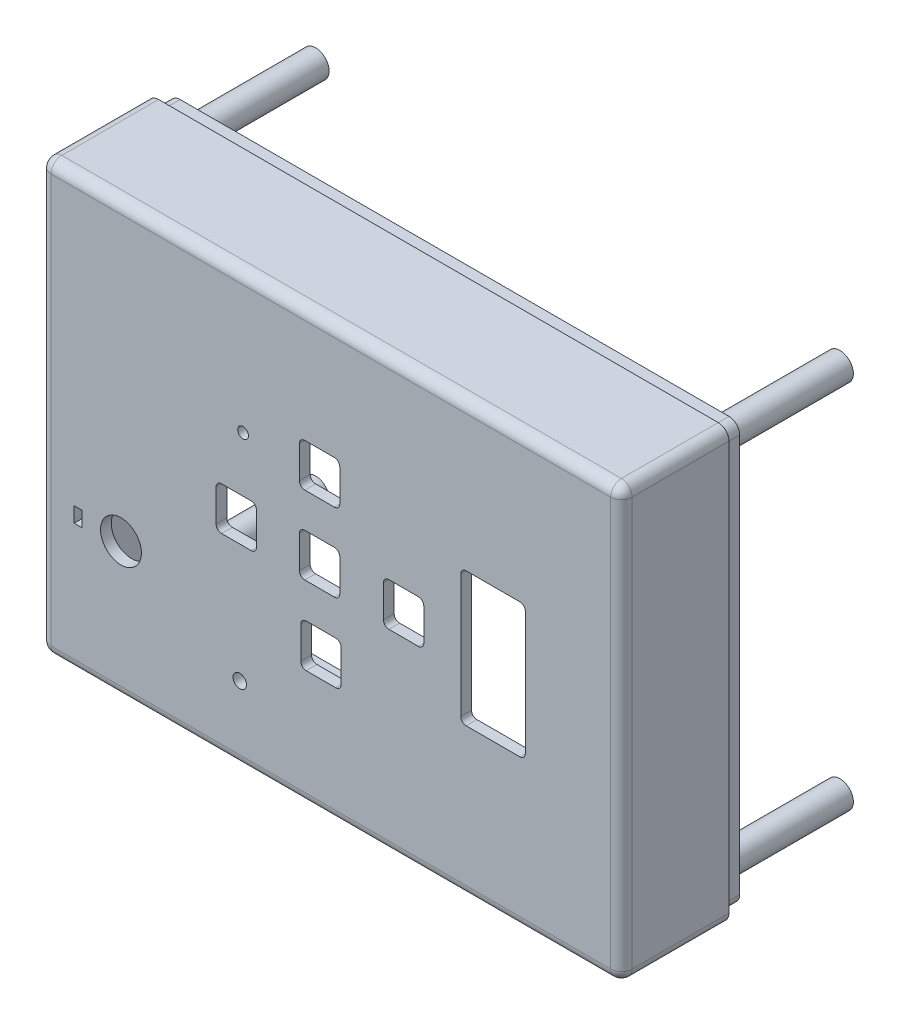
from build123d import *

# Parameters (mm, degrees)
BOSS_EXTRUDE1_DEPTH                       = 5
BOSS_EXTRUDE1_DEPTH_BACK                  = 15
SKETCH2_W                                 = 108.058124592
SKETCH2_H                                 = 80
SHELL4_T                                  = -2
SKETCH1_R                                 = 1
SKETCH1_R_2                               = 3.8
SKETCH1_W                                 = 7.5000007
SKETCH1_H                                 = 7.999999344
SKETCH1_W_2                               = 7.50000035
SKETCH1_H_2                               = 7.999999672
SKETCH1_H_3                               = 7.999999673
SKETCH1_W_3                               = 12
SKETCH1_H_4                               = 24.955992996
SKETCH1_W_4                               = 1.5
SKETCH1_H_5                               = 2.8
CUT_EXTRUDE1_DEPTH                        = 10
FILLET2_R                                 = 2
FILLET3_R                                 = 1
SKETCH5_R                                 = 2.5
BOSS_EXTRUDE3_DEPTH                       = 41
BOSS_EXTRUDE3_2_DEPTH                     = 41
BOSS_EXTRUDE3_3_DEPTH                     = 41
BOSS_EXTRUDE3_4_DEPTH                     = 41
SKETCH6_R                                 = 1.25
CUT_EXTRUDE2_DEPTH                        = 108.680047108
SKETCH7_W                                 = 106.058124592
SKETCH7_H                                 = 78
BOSS_EXTRUDE4_DEPTH                       = 3
F_34_0_111_DIAMETER_HOLE1_AT_2_COUNT      = 2
F_34_0_111_DIAMETER_HOLE1_AT_2_PITCH      = 97.471911114
F_34_0_111_DIAMETER_HOLE1_AT_3_COUNT      = 2
F_34_0_111_DIAMETER_HOLE1_AT_3_PITCH      = 119.398071447
F_34_0_111_DIAMETER_HOLE1_AT_4_COUNT      = 2
F_34_0_111_DIAMETER_HOLE1_AT_4_PITCH      = 68.957421711
SKETCH11_R                                = 2.9
BOSS_EXTRUDE5_DEPTH                       = 10
CSK_FOR_2_FLAT_HEAD_MACHINE_SCREW_2_COUNT = 2
CSK_FOR_2_FLAT_HEAD_MACHINE_SCREW_2_PITCH = 29.21
CSK_FOR_2_FLAT_HEAD_MACHINE_SCREW_3_COUNT = 2
CSK_FOR_2_FLAT_HEAD_MACHINE_SCREW_3_PITCH = 78.188486275
CSK_FOR_2_FLAT_HEAD_MACHINE_SCREW_4_COUNT = 2
CSK_FOR_2_FLAT_HEAD_MACHINE_SCREW_4_PITCH = 64.503754884
FILLET4_R                                 = 1
FILLET5_R                                 = 2


with BuildPart() as part:
    # Sketch2 → Boss-Extrude1 (new, two sides: drawn at the far end of the back side and taken through both)
    with BuildSketch(Plane.XY.offset(-BOSS_EXTRUDE1_DEPTH_BACK)):
        with Locations((-26.35506251, -18.756999791)):
            Rectangle(SKETCH2_W, SKETCH2_H)
    extrude(amount=BOSS_EXTRUDE1_DEPTH + BOSS_EXTRUDE1_DEPTH_BACK)

    # Shell4
    shell4_openings = [part.faces().sort_by_distance(p)[0] for p in [
        (-26.35506251, -18.756999791, -15),
    ]]
    offset(amount=SHELL4_T, openings=shell4_openings, kind=Kind.INTERSECTION)

    # Sketch1 → Cut-Extrude1 (cut)
    with BuildSketch(Plane.XY):
        with Locations((-42.67200177, -4.571998962)):
            Circle(SKETCH1_R)
        with Locations((-65.384124806, -33.407883165)):
            Circle(SKETCH1_R_2)
        with Locations((-28.194001129, -33.019997009)):
            Rectangle(SKETCH1_W, SKETCH1_H)
        with Locations((-28.447998932, -4.064003357)):
            Rectangle(SKETCH1_W, SKETCH1_H)
        with Locations((-28.447998932, -18.542000183)):
            Rectangle(SKETCH1_W, SKETCH1_H)
        with Locations((-43.941998413, -18.795997986)):
            Rectangle(SKETCH1_W_2, SKETCH1_H_2)
        with Locations((-12.827000549, -18.668999085)):
            Rectangle(SKETCH1_W_2, SKETCH1_H_3)
        with Locations((3.8, -18.542000183)):
            Rectangle(SKETCH1_W_3, SKETCH1_H_4)
        with Locations((-73.334440798, -33.438010953)):
            Rectangle(SKETCH1_W_4, SKETCH1_H_5)
    extrude(amount=CUT_EXTRUDE1_DEPTH, mode=Mode.SUBTRACT)

    # Fillet2
    fillet2_edges = [part.edges().sort_by_distance(p)[0] for p in [
        (-80.384124806, -18.756999791, 5),
        (-26.35506251, -58.756999791, 5),
        (27.673999786, -18.756999791, 5),
        (-26.35506251, 21.243000209, 5),
        (-80.384124806, 21.243000209, -5),
        (27.673999786, 21.243000209, -5),
        (27.673999786, -58.756999791, -5),
        (-80.384124806, -58.756999791, -5),
    ]]
    fillet(fillet2_edges, radius=FILLET2_R)

    # Fillet3
    fillet3_edges = [part.edges().sort_by_distance(p)[0] for p in [
        (-78.384124806, -56.756999791, -6),
        (-78.384124806, 19.243000209, -6),
        (25.673999786, 19.243000209, -6),
        (25.673999786, -56.756999791, -6),
        (-78.384124806, -18.756999791, 3),
        (-26.35506251, -56.756999791, 3),
        (25.673999786, -18.756999791, 3),
        (-26.35506251, 19.243000209, 3),
    ]]
    fillet(fillet3_edges, radius=FILLET3_R)

    # Sketch6 → Cut-Extrude2 (cut, through all)
    with BuildSketch(Plane.XY):
        with Locations((-43.300399836, -44.849637416)):
            Circle(SKETCH6_R)
    extrude(amount=CUT_EXTRUDE2_DEPTH, mode=Mode.SUBTRACT)

    # Sketch7 → Boss-Extrude4 (add)
    with BuildSketch(Plane(origin=(0, 0, -15), x_dir=(-1, 0, 0), z_dir=(0, 0, -1))):
        with Locations((26.35506251, -18.756999791)):
            Rectangle(SKETCH7_W, SKETCH7_H)
        with BuildLine():
            Line((-24.673999786, 19.243000209), (77.384124806, 19.243000209))
            ThreePointArc((77.384124806, 19.243000209), (78.091231587, 18.950106991), (78.384124806, 18.243000209))
            Line((78.384124806, 18.243000209), (78.384124806, -55.756999791))
            ThreePointArc((78.384124806, -55.756999791), (78.091231587, -56.464106572), (77.384124806, -56.756999791))
            Line((77.384124806, -56.756999791), (-24.673999786, -56.756999791))
            ThreePointArc((-24.673999786, -56.756999791), (-25.381106568, -56.464106572), (-25.673999786, -55.756999791))
            Line((-25.673999786, -55.756999791), (-25.673999786, 18.243000209))
            ThreePointArc((-25.673999786, 18.243000209), (-25.381106568, 18.950106991), (-24.673999786, 19.243000209))
        make_face(mode=Mode.SUBTRACT)
    extrude(amount=BOSS_EXTRUDE4_DEPTH)

    # Sketch11 → Boss-Extrude5 (add)
    with BuildSketch(Plane(origin=(0, 0, 3), x_dir=(-1, 0, 0), z_dir=(0, 0, -1))):
        with Locations(Location((50.165, 1.575601264, 0), (0, 0, 180))):
            Circle(SKETCH11_R)
        with Locations(Location((50.165, -52.451, 0), (0, 0, 180))):
            Circle(SKETCH11_R)
        with Locations(Location((-13.716, -7.366, 0), (0, 0, 180))):
            Circle(SKETCH11_R)
        with Locations(Location((-13.716, -36.576, 0), (0, 0, 180))):
            Circle(SKETCH11_R)
    extrude(amount=BOSS_EXTRUDE5_DEPTH)

    # Sketch12 → CSK for #2 Flat Head Machine Screw (100)1 (revolve, cut)
    with BuildSketch(Plane(origin=(13.716, -7.366, -7), x_dir=(0, 1, 0), z_dir=(1, 0, 0))):
        Polygon((0, 0), (0, 5), (1.2192, 4.267430733), (1.2192, 0.809898964), (2.1844, 0), align=None)
    csk_for_2_flat_head_machine_screw_100 = revolve(axis=Axis((13.716, -7.366, -13.35), (0, 0, 1)), mode=Mode.SUBTRACT)

    # CSK for _2 Flat Head Machine Screw _ 2: CSK for #2 Flat Head Machine Screw (100)1 ×2
    with Locations(*[(0, -i * CSK_FOR_2_FLAT_HEAD_MACHINE_SCREW_2_PITCH, 0) for i in range(1, CSK_FOR_2_FLAT_HEAD_MACHINE_SCREW_2_COUNT)]):
        add(csk_for_2_flat_head_machine_screw_100, mode=Mode.SUBTRACT)

    # CSK for _2 Flat Head Machine Screw _ 3: CSK for #2 Flat Head Machine Screw (100)1 ×2
    with Locations(*[Vector(-0.8170128754660291, -0.5766194250306964, 0) * (i * CSK_FOR_2_FLAT_HEAD_MACHINE_SCREW_3_PITCH) for i in range(1, CSK_FOR_2_FLAT_HEAD_MACHINE_SCREW_3_COUNT)]):
        add(csk_for_2_flat_head_machine_screw_100, mode=Mode.SUBTRACT)

    # CSK for _2 Flat Head Machine Screw _ 4: CSK for #2 Flat Head Machine Screw (100)1 ×2
    with Locations(*[Vector(-0.9903454475576021, 0.13862140708394505, 0) * (i * CSK_FOR_2_FLAT_HEAD_MACHINE_SCREW_4_PITCH) for i in range(1, CSK_FOR_2_FLAT_HEAD_MACHINE_SCREW_4_COUNT)]):
        add(csk_for_2_flat_head_machine_screw_100, mode=Mode.SUBTRACT)

    # Fillet4
    fillet4_edges = [part.edges().sort_by_distance(p)[0] for p in [
        (-32.197999282, -0.064003685, 4),
        (-32.197999282, -8.064003029, 4),
        (-24.697998582, -8.064003029, 4),
        (-24.697998582, -0.064003685, 4),
        (-31.944001479, -29.019997337, 4),
        (-31.944001479, -37.019996681, 4),
        (-24.444000779, -37.019996681, 4),
        (-24.444000779, -29.019997337, 4),
        (-32.197999282, -14.542000511, 4),
        (-32.197999282, -22.541999855, 4),
        (-24.697998582, -22.541999855, 4),
        (-24.697998582, -14.542000511, 4),
        (-47.691998588, -14.79599815, 4),
        (-47.691998588, -22.795997822, 4),
        (-40.191998238, -22.795997822, 4),
        (-40.191998238, -14.79599815, 4),
        (-16.577000724, -14.668999248, 4),
        (-16.577000724, -22.668998921, 4),
        (-9.077000374, -22.668998921, 4),
        (-9.077000374, -14.668999248, 4),
        (-2.2, -6.064003685, 4),
        (-2.2, -31.019996681, 4),
        (9.8, -31.019996681, 4),
        (9.8, -6.064003685, 4),
    ]]
    fillet(fillet4_edges, radius=FILLET4_R)

    # Fillet5
    fillet5_edges = [part.edges().sort_by_distance(p)[0] for p in [
        (26.673999786, 20.243000209, -16.5),
        (26.673999786, -57.756999791, -16.5),
        (-79.384124806, -57.756999791, -16.5),
        (-79.384124806, 20.243000209, -16.5),
    ]]
    fillet(fillet5_edges, radius=FILLET5_R)


with BuildPart() as body_2:
    # Sketch5 → Boss-Extrude3 (new body)
    with BuildSketch(Plane.XY):
        with Locations((22.303384668, 15.674834124)):
            Circle(SKETCH5_R)
    extrude(amount=-BOSS_EXTRUDE3_DEPTH)


with BuildPart() as body_3:
    # Sketch5 → Boss-Extrude3 2 (new body)
    with BuildSketch(Plane.XY):
        with Locations((-75.168526445, 15.674834124)):
            Circle(SKETCH5_R)
    extrude(amount=-BOSS_EXTRUDE3_2_DEPTH)


with BuildPart() as body_4:
    # Sketch5 → Boss-Extrude3 3 (new body)
    with BuildSketch(Plane.XY):
        with Locations((-75.168526445, -53.282587587)):
            Circle(SKETCH5_R)
    extrude(amount=-BOSS_EXTRUDE3_3_DEPTH)


with BuildPart() as body_5:
    # Sketch5 → Boss-Extrude3 4 (new body)
    with BuildSketch(Plane.XY):
        with Locations((22.303384668, -53.282587587)):
            Circle(SKETCH5_R)
    extrude(amount=-BOSS_EXTRUDE3_4_DEPTH)

    # Sketch9 → #34 (0.111) Diameter Hole1 (revolve, cut)
    with BuildSketch(Plane(origin=(22.303384668, -53.282587587, -41), x_dir=(0, 1, 0), z_dir=(1, 0, 0))):
        Polygon((0, 0), (0, 15), (1.4097, 14.152966785), (1.4097, 0), align=None)
    f_34_0_111_diameter_hole1 = revolve(axis=Axis((22.303384668, -53.282587587, -47.35), (0, 0, 1)), mode=Mode.SUBTRACT)


with BuildPart() as body_4_1:
    add(body_4.part)

    # #34 (0.111) Diameter Hole1 at 2: #34 (0.111) Diameter Hole1 ×2
    with Locations(*[(-i * F_34_0_111_DIAMETER_HOLE1_AT_2_PITCH, 0, 0) for i in range(1, F_34_0_111_DIAMETER_HOLE1_AT_2_COUNT)]):
        add(f_34_0_111_diameter_hole1, mode=Mode.SUBTRACT)


with BuildPart() as body_3_1:
    add(body_3.part)

    # #34 (0.111) Diameter Hole1 at 3: #34 (0.111) Diameter Hole1 ×2
    with Locations(*[Vector(-0.8163608501603499, 0.5775421736336411, 0) * (i * F_34_0_111_DIAMETER_HOLE1_AT_3_PITCH) for i in range(1, F_34_0_111_DIAMETER_HOLE1_AT_3_COUNT)]):
        add(f_34_0_111_diameter_hole1, mode=Mode.SUBTRACT)


with BuildPart() as body_2_1:
    add(body_2.part)

    # #34 (0.111) Diameter Hole1 at 4: #34 (0.111) Diameter Hole1 ×2
    with Locations(*[(0, i * F_34_0_111_DIAMETER_HOLE1_AT_4_PITCH, 0) for i in range(1, F_34_0_111_DIAMETER_HOLE1_AT_4_COUNT)]):
        add(f_34_0_111_diameter_hole1, mode=Mode.SUBTRACT)


solid = Compound([part.part, body_5.part, body_4_1.part, body_3_1.part, body_2_1.part])
